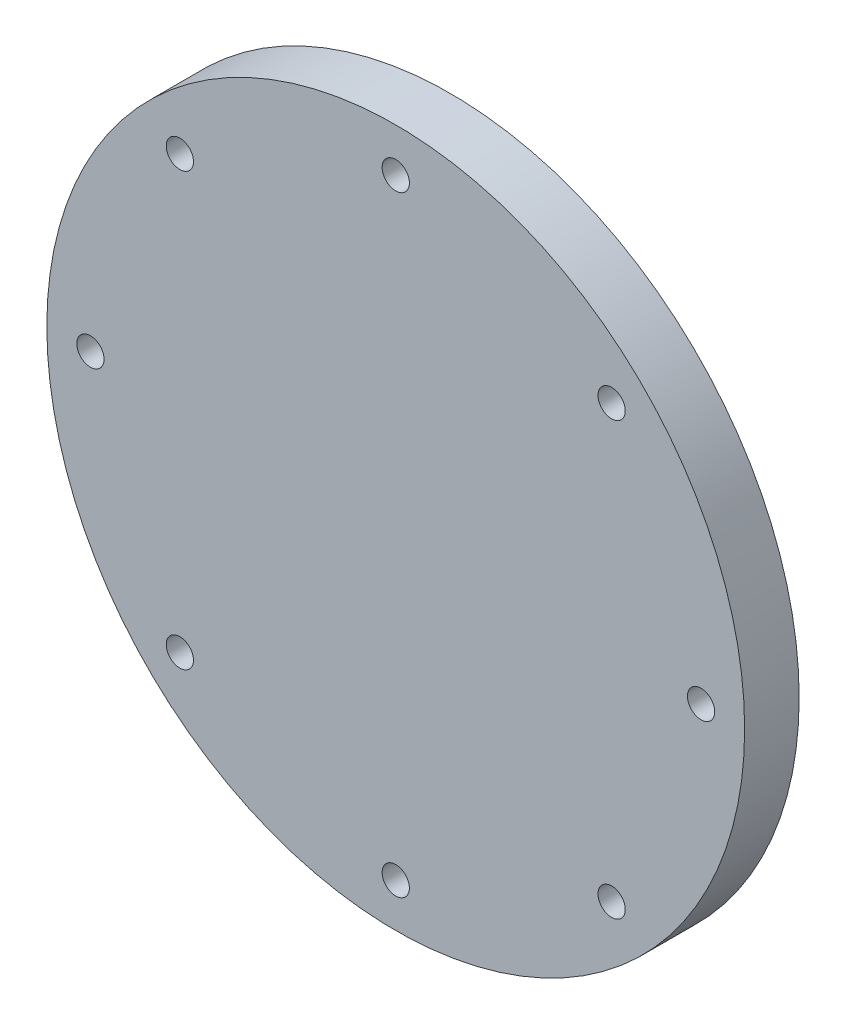
from build123d import *

# Parameters (mm, degrees)
CROQUIS1_R              = 32
SALIENTE_EXTRUIR1_DEPTH = 5
CROQUIS2_R              = 1.25
CORTAR_EXTRUIR1_DEPTH   = 46.530209751


with BuildPart() as part:
    # Croquis1 → Saliente-Extruir1 (new body)
    with BuildSketch(Plane.XY):
        Circle(CROQUIS1_R)
    extrude(amount=SALIENTE_EXTRUIR1_DEPTH)

    # Croquis2 → Cortar-Extruir1 (cut, through all)
    with BuildSketch(Plane.XY.offset(5)):
        with Locations((0, 28)):
            Circle(CROQUIS2_R)
        with Locations((19.798989873, 19.798989873)):
            Circle(CROQUIS2_R)
        with Locations((28, 0)):
            Circle(CROQUIS2_R)
        with Locations((19.798989873, -19.798989873)):
            Circle(CROQUIS2_R)
        with Locations((0, -28)):
            Circle(CROQUIS2_R)
        with Locations((-19.798989873, -19.798989873)):
            Circle(CROQUIS2_R)
        with Locations((-28, 0)):
            Circle(CROQUIS2_R)
        with Locations((-19.798989873, 19.798989873)):
            Circle(CROQUIS2_R)
    extrude(amount=-CORTAR_EXTRUIR1_DEPTH, mode=Mode.SUBTRACT)


solid = part.part
